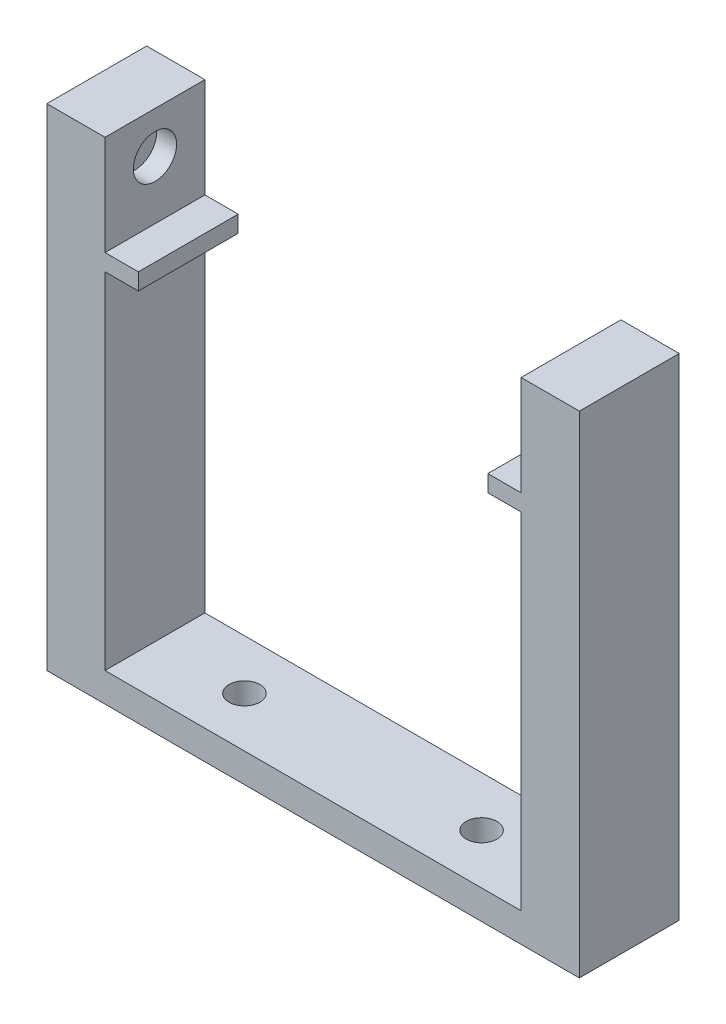
from build123d import *

# Parameters (mm, degrees)
SKETCH1_W           = 64
SKETCH1_H           = 59
SKETCH1_W_2         = 50
SKETCH1_H_2         = 52
BOSS_EXTRUDE1_DEPTH = 12
SKETCH2_R           = 1.85
CUT_EXTRUDE1_DEPTH  = 10
SKETCH3_R           = 1.85
CUT_EXTRUDE2_DEPTH  = 10
SKETCH4_W           = 50
SKETCH4_H           = 12
SKETCH4_R           = 1.85
CUT_EXTRUDE4_DEPTH  = 10
SKETCH6_R           = 2.6
CUT_EXTRUDE5_DEPTH  = 2.4
SKETCH7_W           = 12
SKETCH7_H           = 2
BOSS_EXTRUDE2_DEPTH = 4


with BuildPart() as part:
    # Sketch1 → Boss-Extrude1 (new body)
    with BuildSketch(Plane.XY):
        with Locations((32, 29.5)):
            Rectangle(SKETCH1_W, SKETCH1_H)
        with Locations((32, 29.5)):
            Rectangle(SKETCH1_W_2, SKETCH1_H_2, mode=Mode.SUBTRACT)
    extrude(amount=BOSS_EXTRUDE1_DEPTH)

    # Sketch2 → Cut-Extrude1 (cut)
    with BuildSketch(Plane(origin=(0, 59, 0), x_dir=(1, 0, 0), z_dir=(0, 1, 0))):
        with Locations(Location((18, -9.7, 0), (0, 0, 180))):
            Circle(SKETCH2_R)
        with Locations(Location((46, -9.7, 0), (0, 0, 180))):
            Circle(SKETCH2_R)
        with Locations(Location((32, -9.7, 0), (0, 0, 180))):
            Circle(SKETCH2_R)
    extrude(amount=-CUT_EXTRUDE1_DEPTH, mode=Mode.SUBTRACT)

    # Sketch3 → Cut-Extrude2 (cut)
    with BuildSketch(Plane.XZ):
        with Locations(Location((17.75, 6, 0), (0, 0, 270))):
            Circle(SKETCH3_R)
        with Locations(Location((46.25, 6, 0), (0, 0, 180))):
            Circle(SKETCH3_R)
    extrude(amount=-CUT_EXTRUDE2_DEPTH, mode=Mode.SUBTRACT)

    # Sketch4 → Cut-Extrude4 (cut)
    with BuildSketch(Plane(origin=(0, 59, 0), x_dir=(1, 0, 0), z_dir=(0, 1, 0))):
        with Locations((32, -6)):
            Rectangle(SKETCH4_W, SKETCH4_H)
        with Locations((18, -9.7)):
            Circle(SKETCH4_R, mode=Mode.SUBTRACT)
        with Locations((32, -9.7)):
            Circle(SKETCH4_R, mode=Mode.SUBTRACT)
        with Locations((46, -9.7)):
            Circle(SKETCH4_R, mode=Mode.SUBTRACT)
    extrude(amount=-CUT_EXTRUDE4_DEPTH, mode=Mode.SUBTRACT)

    # Sketch6 → Cut-Extrude5 (cut)
    with BuildSketch(Plane(origin=(7, 0, 0), x_dir=(0, 0, -1), z_dir=(1, 0, 0))):
        with Locations((-6, 54)):
            Circle(SKETCH6_R)
    cut_extrude5 = extrude(amount=-CUT_EXTRUDE5_DEPTH, mode=Mode.SUBTRACT)

    # Mirror1: Cut-Extrude5 across plane
    add(cut_extrude5.mirror(Plane.ZY.offset(-32)), mode=Mode.SUBTRACT)

    # Sketch7 → Boss-Extrude2 (add)
    with BuildSketch(Plane.ZY.offset(-57)):
        with Locations((6, 46)):
            Rectangle(SKETCH7_W, SKETCH7_H)
    boss_extrude2 = extrude(amount=BOSS_EXTRUDE2_DEPTH)

    # Mirror2: Boss-Extrude2 across plane
    add(boss_extrude2.mirror(Plane.ZY.offset(-32)))


solid = part.part
